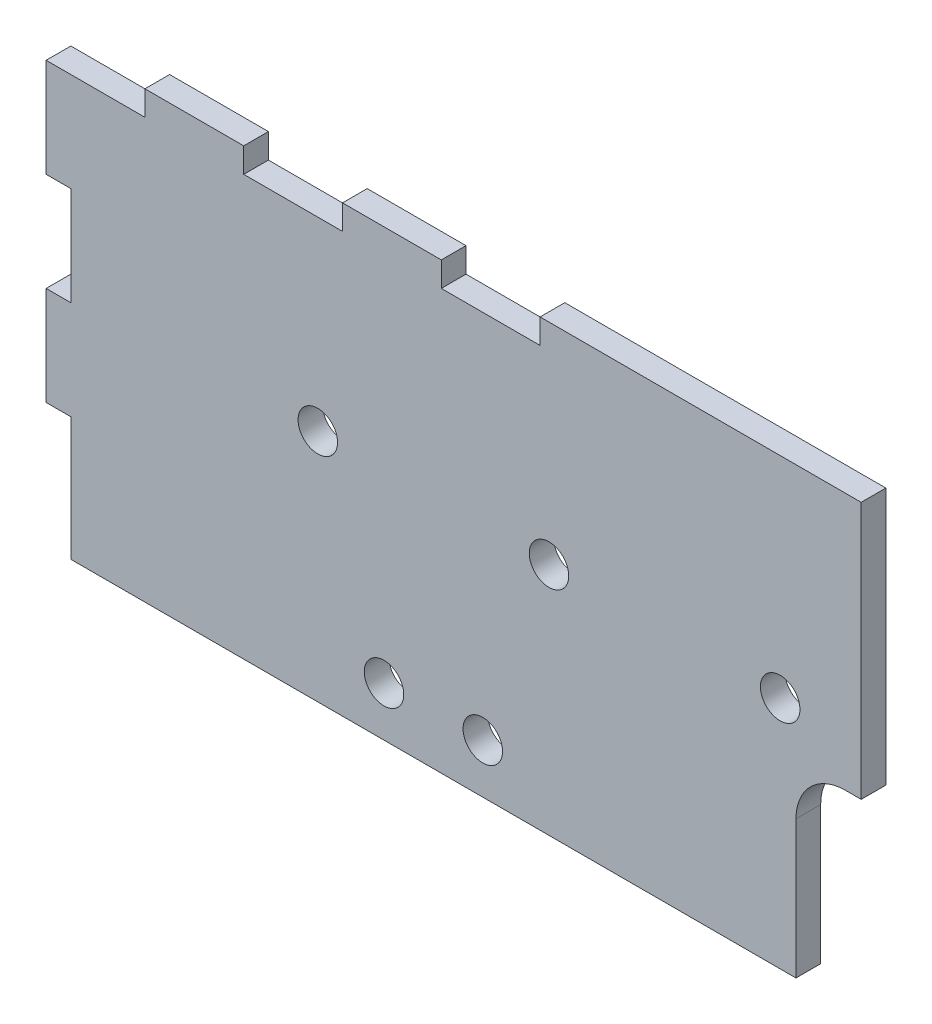
from build123d import *

# Parameters (mm, degrees)
SKETCH1_R           = 2.54
BOSS_EXTRUDE1_DEPTH = 3.175
FILLET1_R           = 6.35


with BuildPart() as part:
    # Sketch1 → Boss-Extrude1 (new body)
    with BuildSketch(Plane.XY):
        Polygon((0, 15.875), (0, 0), (93.218, 0), (93.218, 24.07511214), (101.6, 24.07511214), (101.6, 57.15), (60.325, 57.15), (60.325, 53.975), (47.625, 53.975), (47.625, 57.15), (34.925, 57.15), (34.925, 53.975), (22.225, 53.975), (22.225, 57.15), (9.525, 57.15), (9.525, 53.975), (-3.175, 53.975), (-3.175, 41.275), (0, 41.275), (0, 28.575), (-3.175, 28.575), (-3.175, 15.875), align=None)
        with Locations((40.259, 6.35)):
            Circle(SKETCH1_R, mode=Mode.SUBTRACT)
        with Locations((52.959, 6.35)):
            Circle(SKETCH1_R, mode=Mode.SUBTRACT)
        with Locations((31.75, 30.1498)):
            Circle(SKETCH1_R, mode=Mode.SUBTRACT)
        with Locations((61.468, 30.1498)):
            Circle(SKETCH1_R, mode=Mode.SUBTRACT)
        with Locations((91.186, 30.1498)):
            Circle(SKETCH1_R, mode=Mode.SUBTRACT)
    extrude(amount=BOSS_EXTRUDE1_DEPTH)

    # Fillet1
    fillet1_edges = [part.edges().sort_by_distance(p)[0] for p in [
        (93.218, 24.07511214, 1.5875),
    ]]
    fillet(fillet1_edges, radius=FILLET1_R)


solid = part.part
